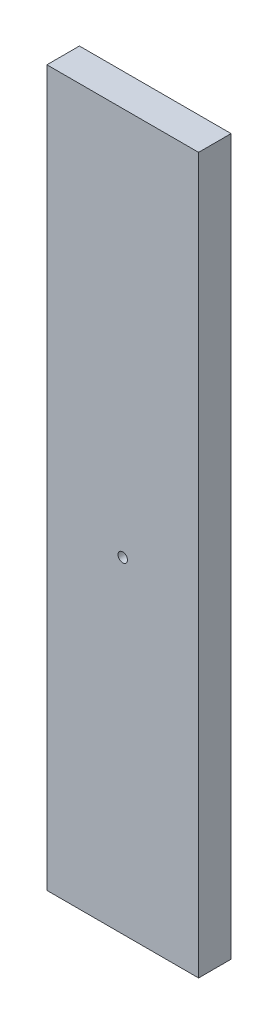
from build123d import *

# Parameters (mm, degrees)
SKETCH1_W           = 88.9
SKETCH1_H           = 19.05
BOSS_EXTRUDE1_DEPTH = 419.1
SKETCH2_R           = 2.778125
CUT_EXTRUDE1_DEPTH  = 429.848367725


with BuildPart() as part:
    # Sketch1 → Boss-Extrude1 (new body)
    with BuildSketch(Plane(origin=(0, 0, 0), x_dir=(1, 0, 0), z_dir=(0, 1, 0))):
        with Locations((44.45, 9.525)):
            Rectangle(SKETCH1_W, SKETCH1_H)
    extrude(amount=BOSS_EXTRUDE1_DEPTH)

    # Sketch2 → Cut-Extrude1 (cut, through all)
    with BuildSketch(Plane.XY):
        with Locations((44.45, 191.301352373)):
            Circle(SKETCH2_R)
    extrude(amount=-CUT_EXTRUDE1_DEPTH, mode=Mode.SUBTRACT)


solid = part.part
